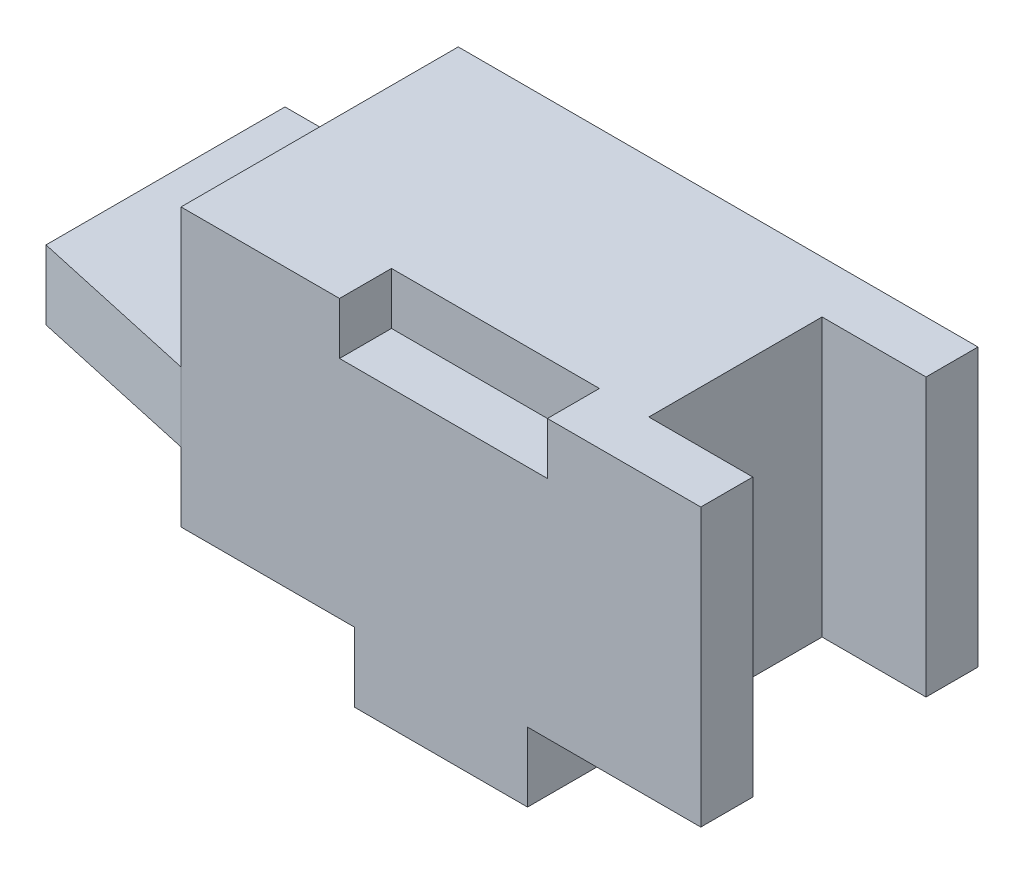
from build123d import *

# Parameters (mm, degrees)
SKETCH_1_W               = 50
SKETCH_1_H               = 20
SKETCH_1_W_2             = 150
SKETCH_1_H_2             = 80
EXTRUDE_3_DEPTH          = 80
SKETCH_3_W               = 80
SKETCH_3_H               = 20
EXTRUDE_4_DEPTH          = 50
CUT_EXTRUDE_1_DEPTH      = 181.277563773
CUT_EXTRUDE_1_DEPTH_BACK = 50
SKETCH_5_W               = 50
SKETCH_5_H               = 80
CUT_EXTRUDE_2_DEPTH      = 30
SKETCH_6_W               = 60
SKETCH_6_H               = 15
CUT_EXTRUDE_3_DEPTH      = 15


with BuildPart() as part:
    # Эскиз1 → Бобышка-Вытянуть3 (new body)
    with BuildSketch(Plane.XY):
        with Locations((75, -90)):
            Rectangle(SKETCH_1_W, SKETCH_1_H)
        with Locations((75, -40)):
            Rectangle(SKETCH_1_W_2, SKETCH_1_H_2)
    extrude(amount=EXTRUDE_3_DEPTH)

    # Эскиз3 → Бобышка-Вытянуть4 (add)
    with BuildSketch(Plane.ZY):
        with Locations((40, -50)):
            Rectangle(SKETCH_3_W, SKETCH_3_H)
    extrude(amount=EXTRUDE_4_DEPTH)

    # Эскиз4 → Вырез-Вытянуть1 (cut, two sides: drawn at the far end of the back side and taken through both)
    with BuildSketch(Plane.XZ.offset(60).offset(-CUT_EXTRUDE_1_DEPTH_BACK)):
        Polygon((-50, 70.981091189), (-50, 68.967879487), (0, 80), (-50, 80), align=None)
    extrude(amount=CUT_EXTRUDE_1_DEPTH + CUT_EXTRUDE_1_DEPTH_BACK, mode=Mode.SUBTRACT)

    # Эскиз5 → Вырез-Вытянуть2 (cut)
    with BuildSketch(Plane(origin=(150, 0, 0), x_dir=(0, 0, -1), z_dir=(1, 0, 0))):
        with Locations((-40, -40)):
            Rectangle(SKETCH_5_W, SKETCH_5_H)
    extrude(amount=-CUT_EXTRUDE_2_DEPTH, mode=Mode.SUBTRACT)

    # Эскиз6 → Вырез-Вытянуть3 (cut)
    with BuildSketch(Plane.XY.offset(80)):
        with Locations((75.739234494, -7.5)):
            Rectangle(SKETCH_6_W, SKETCH_6_H)
    extrude(amount=-CUT_EXTRUDE_3_DEPTH, mode=Mode.SUBTRACT)


solid = part.part
